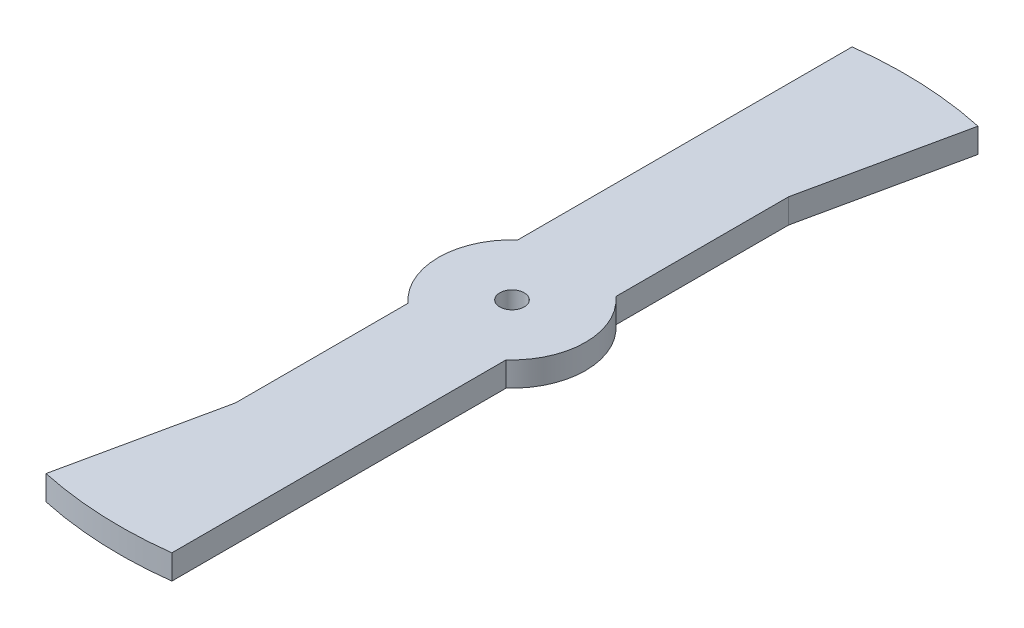
from build123d import *

# Parameters (mm, degrees)
SKETCH1_R           = 3.175
BOSS_EXTRUDE1_DEPTH = 6.35


with BuildPart() as part:
    # Sketch1 → Boss-Extrude1 (new body)
    with BuildSketch(Plane(origin=(0, 0, 0), x_dir=(1, 0, 0), z_dir=(0, 1, 0))):
        with BuildLine():
            ThreePointArc((12.7, 14.199031657), (19.05, 0), (12.7, -14.199031657))
            Line((12.7, -14.199031657), (12.7, -100.803124952))
            ThreePointArc((12.7, -100.803124952), (-4.407318933, -101.504362171), (-21.389473684, -99.322960163))
            Line((-21.389473684, -99.322960163), (-12.7, -58.973007597))
            Line((-12.7, -58.973007597), (-12.7, -14.199031657))
            ThreePointArc((-12.7, -14.199031657), (-19.05, 0), (-12.7, 14.199031657))
            Line((-12.7, 14.199031657), (-12.7, 100.803124952))
            ThreePointArc((-12.7, 100.803124952), (4.407318933, 101.504362171), (21.389473684, 99.322960163))
            Line((21.389473684, 99.322960163), (12.7, 58.973007597))
            Line((12.7, 58.973007597), (12.7, 14.199031657))
        make_face()
        with Locations(Location((0, 0, 0), (0, 0, 270))):
            Circle(SKETCH1_R, mode=Mode.SUBTRACT)
    extrude(amount=BOSS_EXTRUDE1_DEPTH)


solid = part.part
